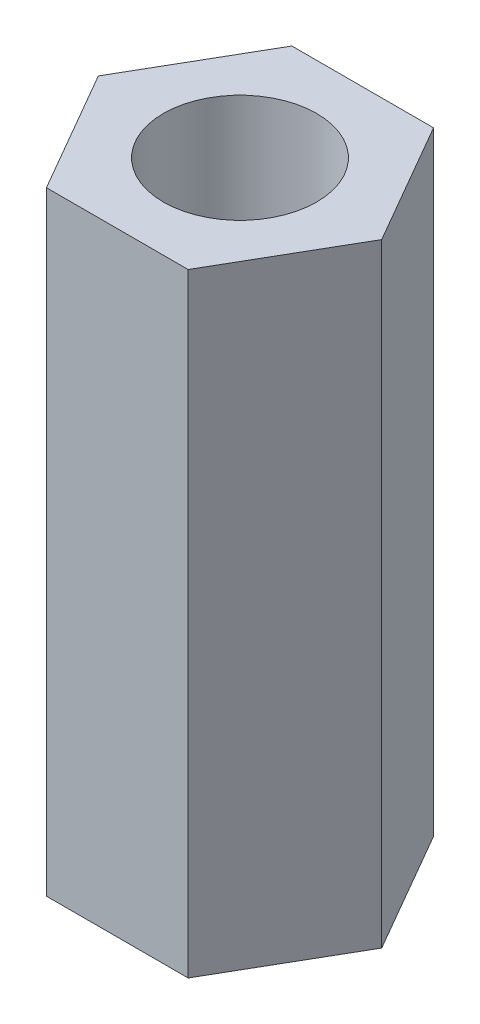
from build123d import *

# Parameters (mm, degrees)
SKETCH_1_R      = 1.25
EXTRUDE_1_DEPTH = 10


with BuildPart() as part:
    # 草图1 → 凸台-拉伸1 (new body)
    with BuildSketch(Plane(origin=(0, 0, 0), x_dir=(1, 0, 0), z_dir=(0, 1, 0))):
        Polygon((1.154700538, 2), (-1.154700538, 2), (-2.309401077, 0), (-1.154700538, -2), (1.154700538, -2), (2.309401077, 0), align=None)
        with Locations(Location((0, 0, 0), (0, 0, 270))):
            Circle(SKETCH_1_R, mode=Mode.SUBTRACT)
    extrude(amount=EXTRUDE_1_DEPTH)


solid = part.part
